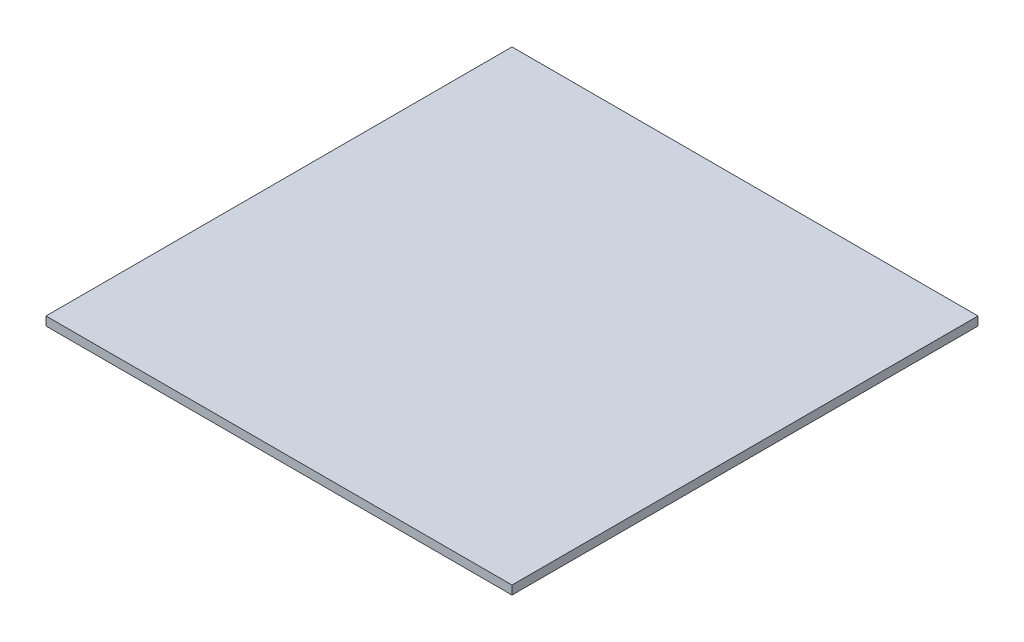
from build123d import *

# Parameters (mm, degrees)
SKETCH_1_W      = 80
SKETCH_1_H      = 80
EXTRUDE_1_DEPTH = 1.5


with BuildPart() as part:
    # Эскиз1 → Бобышка-Вытянуть1 (new body)
    with BuildSketch(Plane(origin=(0, 0, 0), x_dir=(1, 0, 0), z_dir=(0, 1, 0))):
        with Locations((40, 40)):
            Rectangle(SKETCH_1_W, SKETCH_1_H)
    extrude(amount=EXTRUDE_1_DEPTH)


solid = part.part
